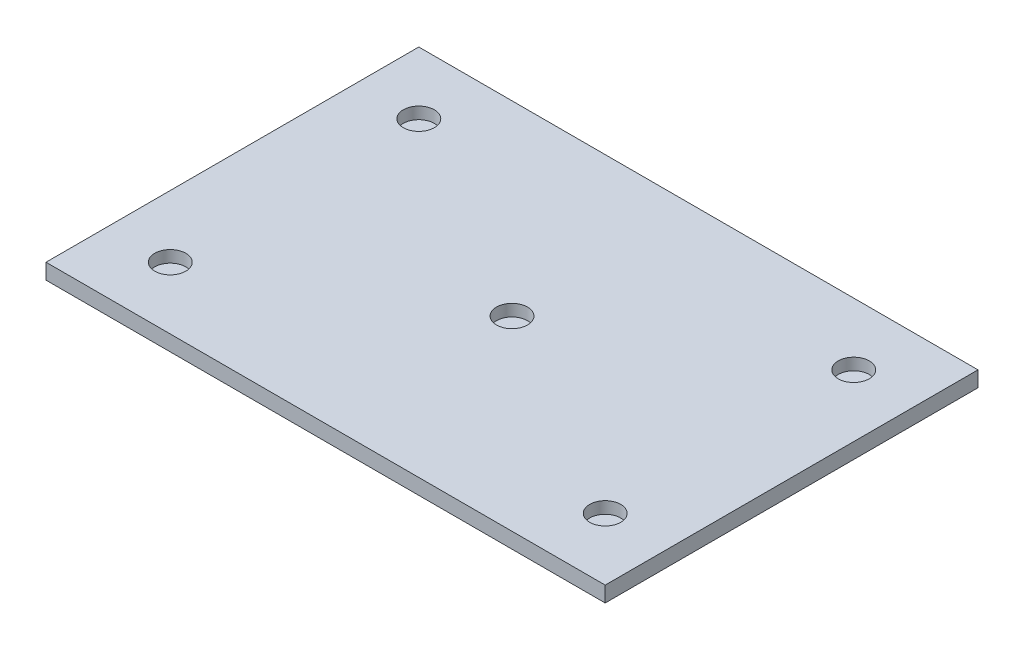
from build123d import *

# Parameters (mm, degrees)
SKETCH1_W           = 228.6
SKETCH1_H           = 152.4
BOSS_EXTRUDE1_DEPTH = 6.35
SKETCH2_R           = 6.35
CUT_EXTRUDE1_DEPTH  = 4.826


with BuildPart() as part:
    # Sketch1 → Boss-Extrude1 (new body)
    with BuildSketch(Plane(origin=(0, 0, 0), x_dir=(1, 0, 0), z_dir=(0, 1, 0))):
        Rectangle(SKETCH1_W, SKETCH1_H)
    extrude(amount=BOSS_EXTRUDE1_DEPTH)

    # Sketch2 → Cut-Extrude1 (cut)
    with BuildSketch(Plane(origin=(0, 6.35, 0), x_dir=(1, 0, 0), z_dir=(0, 1, 0))):
        with Locations(Location((-88.9, 50.8, 0), (0, 0, 270))):
            Circle(SKETCH2_R)
        with Locations(Location((-88.9, -50.8, 0), (0, 0, 90))):
            Circle(SKETCH2_R)
        with Locations(Location((88.9, -50.8, 0), (0, 0, 270))):
            Circle(SKETCH2_R)
        with Locations(Location((88.9, 50.8, 0), (0, 0, 90))):
            Circle(SKETCH2_R)
        with Locations(Location((0, 0, 0), (0, 0, 270))):
            Circle(SKETCH2_R)
    extrude(amount=-CUT_EXTRUDE1_DEPTH, mode=Mode.SUBTRACT)


solid = part.part
